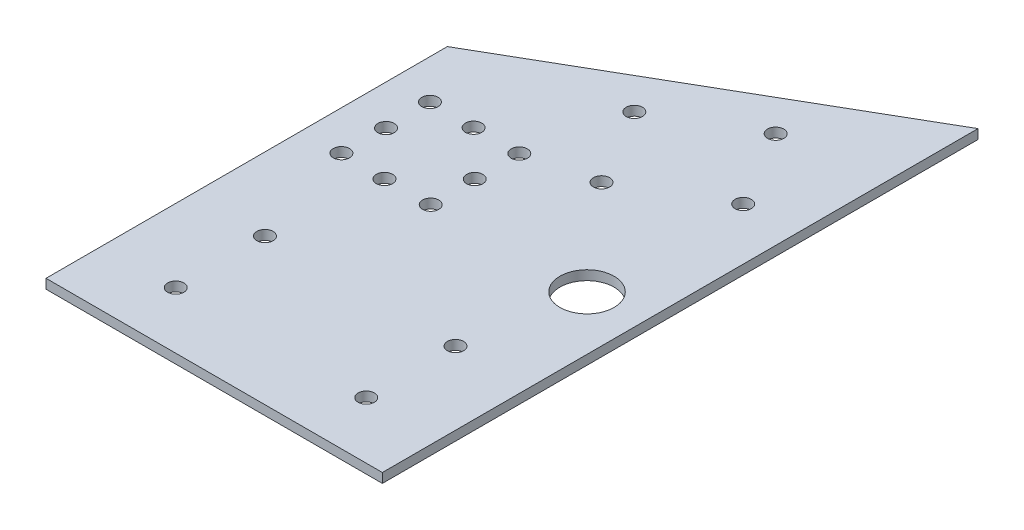
from build123d import *

# Parameters (mm, degrees)
SKETCH4_R                  = 10
BOSS_EXTRUDE1_DEPTH        = 3.5
F_6_0MM_DOWEL_HOLE3_D      = 6
F_6_0MM_DOWEL_HOLE4_D      = 6
F_6_0MM_DOWEL_HOLE5_D      = 6
F_6_0MM_DOWEL_HOLE6_D      = 6
F_6_0MM_DOWEL_HOLE7_D      = 6
F_6_0MM_DOWEL_HOLE8_D      = 6
F_6_0MM_DOWEL_HOLE9_D      = 6
F_6_0MM_DOWEL_HOLE10_D     = 6
F_6_0MM_DOWEL_HOLE11_D     = 6
F_6_0MM_DOWEL_HOLE12_D     = 6
F_6_0MM_DOWEL_HOLE13_D     = 6
F_6_0MM_DOWEL_HOLE14_D     = 6
F_6_0MM_DOWEL_HOLE15_D     = 6
F_6_0MM_DOWEL_HOLE16_D     = 6
F_6_0MM_DOWEL_HOLE17_D     = 6
F_6_0MM_DOWEL_HOLE17_DEPTH = 30.64
F_6_0MM_DOWEL_HOLE17_TIP   = 1.802581857
F_6_0MM_DOWEL_HOLE18_D     = 6
F_6_0MM_DOWEL_HOLE18_DEPTH = 30.64
F_6_0MM_DOWEL_HOLE18_TIP   = 1.802581857
F_6_0MM_DOWEL_HOLE19_D     = 6
F_6_0MM_DOWEL_HOLE19_DEPTH = 30.64
F_6_0MM_DOWEL_HOLE19_TIP   = 1.802581857
F_6_0MM_DOWEL_HOLE20_D     = 6
F_6_0MM_DOWEL_HOLE20_DEPTH = 30.64
F_6_0MM_DOWEL_HOLE20_TIP   = 1.802581857
F_6_0MM_DOWEL_HOLE21_D     = 6
F_6_0MM_DOWEL_HOLE22_D     = 6
F_6_0MM_DOWEL_HOLE23_D     = 6
F_6_0MM_DOWEL_HOLE24_D     = 6
F_6_0MM_DOWEL_HOLE25_D     = 6
F_6_0MM_DOWEL_HOLE26_D     = 6
F_6_0MM_DOWEL_HOLE27_D     = 6
F_6_0MM_DOWEL_HOLE28_D     = 6
F_6_0MM_DOWEL_HOLE29_D     = 6
F_6_0MM_DOWEL_HOLE30_D     = 6


with BuildPart() as part:
    # Sketch4 → Boss-Extrude1 (new body)
    with BuildSketch(Plane(origin=(0, 0, 0), x_dir=(1, 0, 0), z_dir=(0, 1, 0))):
        Polygon((-36.7366, -50), (87.5, -50), (87.5, 0), (87.5, 130), (87.5, 170), (-36.7366, 98.239824704), (-36.7366, 58.239824704), (-36.7366, 23.58328615), align=None)
        with Locations(Location((67.5, 45.58328615, 0), (0, 0, 270))):
            Circle(SKETCH4_R, mode=Mode.SUBTRACT)
    extrude(amount=BOSS_EXTRUDE1_DEPTH)

    # Ø6.0mm Dowel Hole3 (through all)
    with Locations(Plane(origin=(-105.59791448, -96.5, 23.604755291), x_dir=(-1, 0, 0), z_dir=(0, -1, 0))):
        with Locations((-166.162017209, -5.414641336)):
            Hole(F_6_0MM_DOWEL_HOLE3_D / 2)

    # Ø6.0mm Dowel Hole4 (through all)
    with Locations(Plane(origin=(-105.59791448, 0, 23.604755291), x_dir=(-1, 0, 0), z_dir=(0, -1, 0))):
        with Locations((-166.162017209, -5.414641336)):
            Hole(F_6_0MM_DOWEL_HOLE4_D / 2)

    # Ø6.0mm Dowel Hole5 (through all)
    with Locations(Plane(origin=(-105.59791448, -96.5, 23.604755291), x_dir=(-1, 0, 0), z_dir=(0, -1, 0))):
        with Locations((-166.175485163, 27.545698678)):
            Hole(F_6_0MM_DOWEL_HOLE5_D / 2)

    # Ø6.0mm Dowel Hole6 (through all)
    with Locations(Plane(origin=(-105.59791448, 0, 23.604755291), x_dir=(-1, 0, 0), z_dir=(0, -1, 0))):
        with Locations((-166.175485163, 27.545698678)):
            Hole(F_6_0MM_DOWEL_HOLE6_D / 2)

    # Ø6.0mm Dowel Hole7 (through all)
    with Locations(Plane(origin=(-105.59791448, -96.5, 23.604755291), x_dir=(-1, 0, 0), z_dir=(0, -1, 0))):
        with Locations((-95.797211751, 27.547482752)):
            Hole(F_6_0MM_DOWEL_HOLE7_D / 2)

    # Ø6.0mm Dowel Hole8 (through all)
    with Locations(Plane(origin=(-105.59791448, 0, 23.604755291), x_dir=(-1, 0, 0), z_dir=(0, -1, 0))):
        with Locations((-95.797211751, 27.547482752)):
            Hole(F_6_0MM_DOWEL_HOLE8_D / 2)

    # Ø6.0mm Dowel Hole9 (through all)
    with Locations(Plane(origin=(-105.59791448, -96.5, 23.604755291), x_dir=(-1, 0, 0), z_dir=(0, -1, 0))):
        with Locations((-83.36131448, 100.914726135)):
            Hole(F_6_0MM_DOWEL_HOLE9_D / 2)

    # Ø6.0mm Dowel Hole10 (through all)
    with Locations(Plane(origin=(-105.59791448, 0, 23.604755291), x_dir=(-1, 0, 0), z_dir=(0, -1, 0))):
        with Locations((-83.36131448, 100.914726135)):
            Hole(F_6_0MM_DOWEL_HOLE10_D / 2)

    # Ø6.0mm Dowel Hole11 (through all)
    with Locations(Plane(origin=(-105.59791448, -96.5, 23.604755291), x_dir=(-1, 0, 0), z_dir=(0, -1, 0))):
        with Locations((-116.36131448, 100.914726135)):
            Hole(F_6_0MM_DOWEL_HOLE11_D / 2)

    # Ø6.0mm Dowel Hole12 (through all)
    with Locations(Plane(origin=(-105.59791448, 0, 23.604755291), x_dir=(-1, 0, 0), z_dir=(0, -1, 0))):
        with Locations((-116.36131448, 100.914726135)):
            Hole(F_6_0MM_DOWEL_HOLE12_D / 2)

    # Ø6.0mm Dowel Hole13 (through all)
    with Locations(Plane(origin=(-105.59791448, -96.5, 23.604755291), x_dir=(-1, 0, 0), z_dir=(0, -1, 0))):
        with Locations((-116.36131448, 68.191325462)):
            Hole(F_6_0MM_DOWEL_HOLE13_D / 2)

    # Ø6.0mm Dowel Hole14 (through all)
    with Locations(Plane(origin=(-105.59791448, 0, 23.604755291), x_dir=(-1, 0, 0), z_dir=(0, -1, 0))):
        with Locations((-116.36131448, 68.191325462)):
            Hole(F_6_0MM_DOWEL_HOLE14_D / 2)

    # Ø6.0mm Dowel Hole15 (through all)
    with Locations(Plane(origin=(-105.59791448, -96.5, 23.604755291), x_dir=(-1, 0, 0), z_dir=(0, -1, 0))):
        with Locations((-83.401438286, 68.177816696)):
            Hole(F_6_0MM_DOWEL_HOLE15_D / 2)

    # Ø6.0mm Dowel Hole16 (through all)
    with Locations(Plane(origin=(-105.59791448, 0, 23.604755291), x_dir=(-1, 0, 0), z_dir=(0, -1, 0))):
        with Locations((-83.401438286, 68.177816696)):
            Hole(F_6_0MM_DOWEL_HOLE16_D / 2)

    # Ø6.0mm Dowel Hole17
    with Locations(Plane(origin=(-105.59791448, 3.5, 23.604755291), x_dir=(1, 0, 0), z_dir=(0, 1, 0))):
        with Locations((83.614280544, 84.439845005)):
            Hole(F_6_0MM_DOWEL_HOLE17_D / 2, depth=F_6_0MM_DOWEL_HOLE17_DEPTH)
            with Locations((0, 0, -(F_6_0MM_DOWEL_HOLE17_DEPTH + F_6_0MM_DOWEL_HOLE17_TIP / 2))):  # 118° drill point
                Cone(0, F_6_0MM_DOWEL_HOLE17_D / 2, F_6_0MM_DOWEL_HOLE17_TIP, mode=Mode.SUBTRACT)

    # Ø6.0mm Dowel Hole18
    with Locations(Plane(origin=(-105.59791448, 3.5, 23.604755291), x_dir=(1, 0, 0), z_dir=(0, 1, 0))):
        with Locations((116.294424018, 84.527773094)):
            Hole(F_6_0MM_DOWEL_HOLE18_D / 2, depth=F_6_0MM_DOWEL_HOLE18_DEPTH)
            with Locations((0, 0, -(F_6_0MM_DOWEL_HOLE18_DEPTH + F_6_0MM_DOWEL_HOLE18_TIP / 2))):  # 118° drill point
                Cone(0, F_6_0MM_DOWEL_HOLE18_D / 2, F_6_0MM_DOWEL_HOLE18_TIP, mode=Mode.SUBTRACT)

    # Ø6.0mm Dowel Hole19
    with Locations(Plane(origin=(-105.59791448, 3.5, 23.604755291), x_dir=(1, 0, 0), z_dir=(0, 1, 0))):
        with Locations((99.602293645, 67.882806011)):
            Hole(F_6_0MM_DOWEL_HOLE19_D / 2, depth=F_6_0MM_DOWEL_HOLE19_DEPTH)
            with Locations((0, 0, -(F_6_0MM_DOWEL_HOLE19_DEPTH + F_6_0MM_DOWEL_HOLE19_TIP / 2))):  # 118° drill point
                Cone(0, F_6_0MM_DOWEL_HOLE19_D / 2, F_6_0MM_DOWEL_HOLE19_TIP, mode=Mode.SUBTRACT)

    # Ø6.0mm Dowel Hole20
    with Locations(Plane(origin=(-105.59791448, 3.5, 23.604755291), x_dir=(1, 0, 0), z_dir=(0, 1, 0))):
        with Locations((99.658582024, 100.737664948)):
            Hole(F_6_0MM_DOWEL_HOLE20_D / 2, depth=F_6_0MM_DOWEL_HOLE20_DEPTH)
            with Locations((0, 0, -(F_6_0MM_DOWEL_HOLE20_DEPTH + F_6_0MM_DOWEL_HOLE20_TIP / 2))):  # 118° drill point
                Cone(0, F_6_0MM_DOWEL_HOLE20_D / 2, F_6_0MM_DOWEL_HOLE20_TIP, mode=Mode.SUBTRACT)

    # Ø6.0mm Dowel Hole21 (through all)
    with Locations(Plane(origin=(-105.59791448, -96.5, 23.604755291), x_dir=(-1, 0, 0), z_dir=(0, -1, 0))):
        with Locations((-173.858224897, 126.122531585)):
            Hole(F_6_0MM_DOWEL_HOLE21_D / 2)

    # Ø6.0mm Dowel Hole22 (through all)
    with Locations(Plane(origin=(-105.59791448, 0, 23.604755291), x_dir=(-1, 0, 0), z_dir=(0, -1, 0))):
        with Locations((-173.858224897, 126.122531585)):
            Hole(F_6_0MM_DOWEL_HOLE22_D / 2)

    # Ø6.0mm Dowel Hole23 (through all)
    with Locations(Plane(origin=(-105.59791448, -96.5, 23.604755291), x_dir=(-1, 0, 0), z_dir=(0, -1, 0))):
        with Locations((-157.37079531, 154.603853756)):
            Hole(F_6_0MM_DOWEL_HOLE23_D / 2)

    # Ø6.0mm Dowel Hole24 (through all)
    with Locations(Plane(origin=(-105.59791448, 0, 23.604755291), x_dir=(-1, 0, 0), z_dir=(0, -1, 0))):
        with Locations((-157.37079531, 154.603853756)):
            Hole(F_6_0MM_DOWEL_HOLE24_D / 2)

    # Ø6.0mm Dowel Hole25 (through all)
    with Locations(Plane(origin=(-105.59791448, -96.5, 23.604755291), x_dir=(-1, 0, 0), z_dir=(0, -1, 0))):
        with Locations((-124.287288406, 135.474563451)):
            Hole(F_6_0MM_DOWEL_HOLE25_D / 2)

    # Ø6.0mm Dowel Hole26 (through all)
    with Locations(Plane(origin=(-105.59791448, 0, 23.604755291), x_dir=(-1, 0, 0), z_dir=(0, -1, 0))):
        with Locations((-124.287288406, 135.474563451)):
            Hole(F_6_0MM_DOWEL_HOLE26_D / 2)

    # Ø6.0mm Dowel Hole27 (through all)
    with Locations(Plane(origin=(-105.59791448, -96.5, 23.604755291), x_dir=(-1, 0, 0), z_dir=(0, -1, 0))):
        with Locations((-140.764255961, 106.890061518)):
            Hole(F_6_0MM_DOWEL_HOLE27_D / 2)

    # Ø6.0mm Dowel Hole28 (through all)
    with Locations(Plane(origin=(-105.59791448, 0, 23.604755291), x_dir=(-1, 0, 0), z_dir=(0, -1, 0))):
        with Locations((-140.764255961, 106.890061518)):
            Hole(F_6_0MM_DOWEL_HOLE28_D / 2)

    # Ø6.0mm Dowel Hole29 (through all)
    with Locations(Plane(origin=(-105.59791448, -96.5, 23.604755291), x_dir=(-1, 0, 0), z_dir=(0, -1, 0))):
        with Locations((-95.797211751, -5.414641336)):
            Hole(F_6_0MM_DOWEL_HOLE29_D / 2)

    # Ø6.0mm Dowel Hole30 (through all)
    with Locations(Plane(origin=(-105.59791448, 0, 23.604755291), x_dir=(-1, 0, 0), z_dir=(0, -1, 0))):
        with Locations((-95.797211751, -5.414641336)):
            Hole(F_6_0MM_DOWEL_HOLE30_D / 2)


solid = part.part
